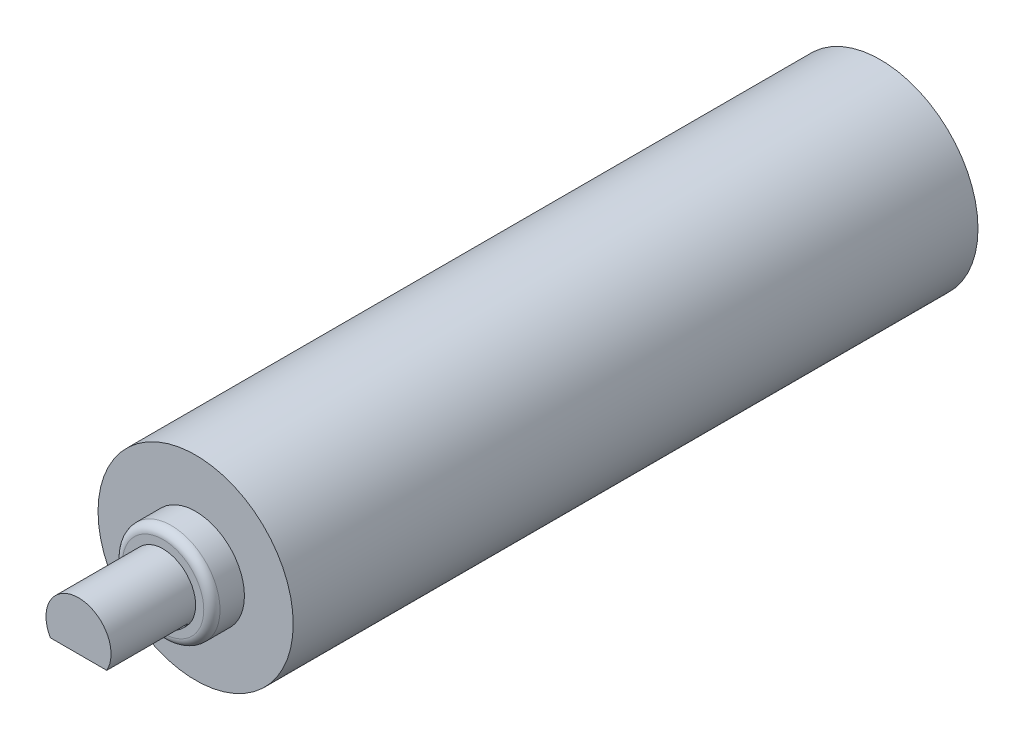
from build123d import *

# Parameters (mm, degrees)
SKETCH_1_R          = 3
EXTRUDE_1_DEPTH     = 21.05
SKETCH_2_R          = 1.5
EXTRUDE_2_DEPTH     = 1
SKETCH_3_R          = 1
EXTRUDE_3_DEPTH     = 2.6
CUT_EXTRUDE_1_DEPTH = 2.5
FILLET_1_R          = 0.25


with BuildPart() as part:
    # 草图1 → 凸台-拉伸1 (new body)
    with BuildSketch(Plane.XY):
        Circle(SKETCH_1_R)
    extrude(amount=-EXTRUDE_1_DEPTH)

    # 草图2 → 凸台-拉伸2 (add)
    with BuildSketch(Plane.XY):
        Circle(SKETCH_2_R)
    extrude(amount=EXTRUDE_2_DEPTH)

    # 草图3 → 凸台-拉伸3 (add)
    with BuildSketch(Plane.XY.offset(1)):
        Circle(SKETCH_3_R)
    extrude(amount=EXTRUDE_3_DEPTH)

    # 草图4 → 切除-拉伸1 (cut)
    with BuildSketch(Plane.XY.offset(3.6)):
        Polygon((0, -0.5), (0.862464595, -0.5), (0.862464595, -1), (0, -1), (-0.86936686, -1), (-0.86936686, -0.5), align=None)
    extrude(amount=-CUT_EXTRUDE_1_DEPTH, mode=Mode.SUBTRACT)

    # 圆角1
    fillet_1_edges = [part.edges().sort_by_distance(p)[0] for p in [
        (-1.5, 0, 1),
    ]]
    fillet(fillet_1_edges, radius=FILLET_1_R)


solid = part.part
